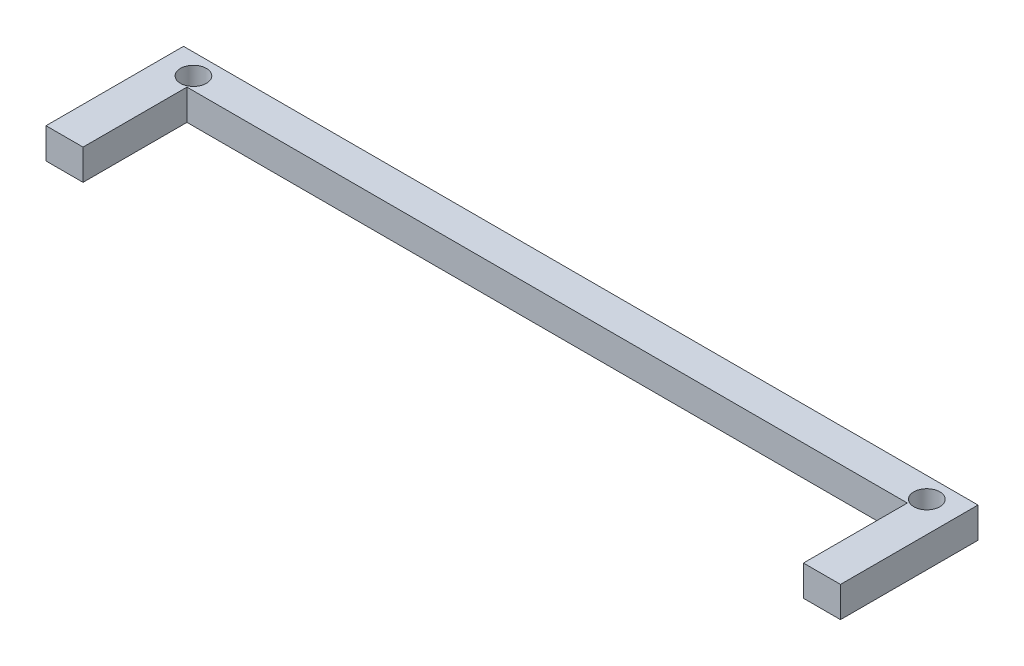
from build123d import *

# Parameters (mm, degrees)
SKETCH1_R           = 4.25
BOSS_EXTRUDE1_DEPTH = 10


with BuildPart() as part:
    # Sketch1 → Boss-Extrude1 (new body)
    with BuildSketch(Plane(origin=(0, 0, 0), x_dir=(1, 0, 0), z_dir=(0, 1, 0))):
        Polygon((-130, 11), (130, 11), (130, 0), (130, -34), (117.875, -34), (117.875, 0), (-117.875, 0), (-117.875, -34), (-130, -34), align=None)
        with Locations(Location((-120, 4.25, 0), (0, 0, 270))):
            Circle(SKETCH1_R, mode=Mode.SUBTRACT)
        with Locations(Location((120, 4.25, 0), (0, 0, 90))):
            Circle(SKETCH1_R, mode=Mode.SUBTRACT)
    extrude(amount=BOSS_EXTRUDE1_DEPTH)


solid = part.part
